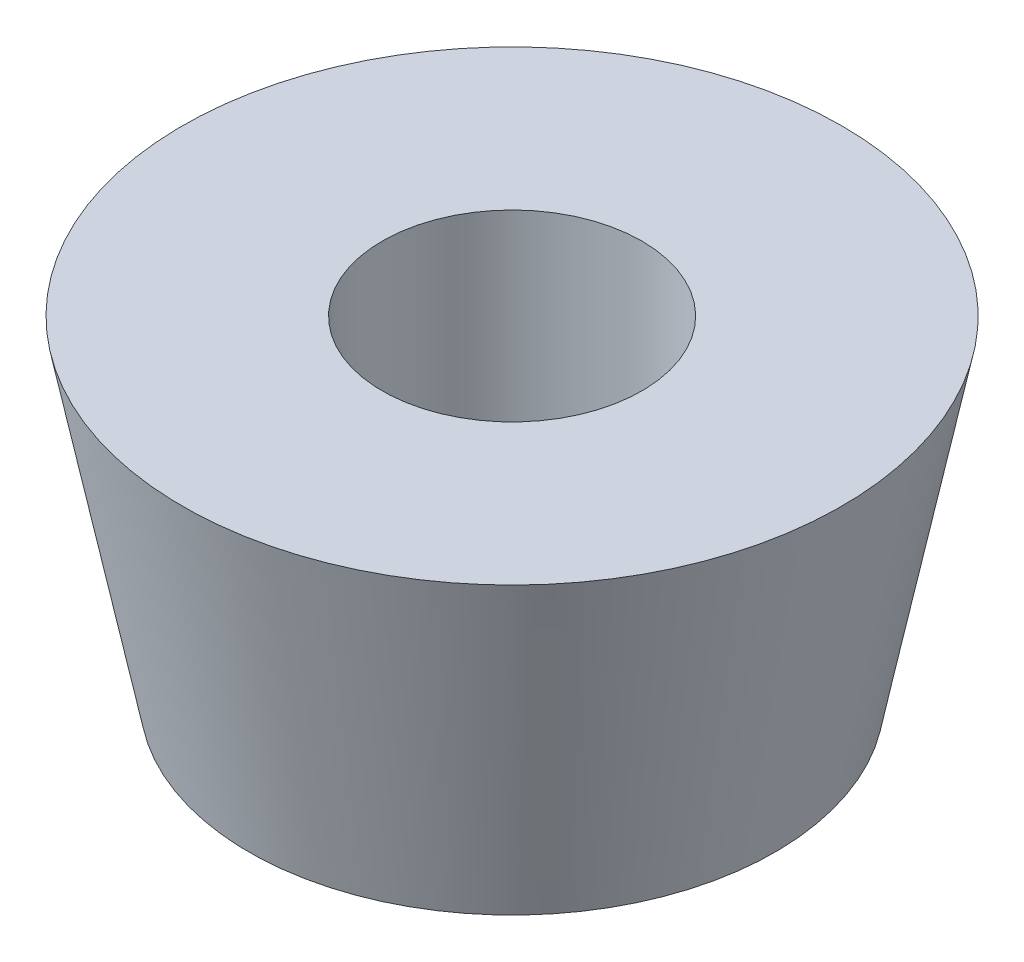
from build123d import *


with BuildPart() as part:
    # Sketch1 → Revolve1 (revolve)
    with BuildSketch(Plane.XY, mode=Mode.PRIVATE) as revolve1_sk:
        Polygon((1.95, 0), (3.95, 0), (4.95, 5), (1.95, 5), align=None)
    revolve(revolve1_sk.sketch.rotate(Axis((0, 0, 0), (0, 1, 0)), 90), axis=Axis((0, 0, 0), (0, 1, 0)))


solid = part.part
